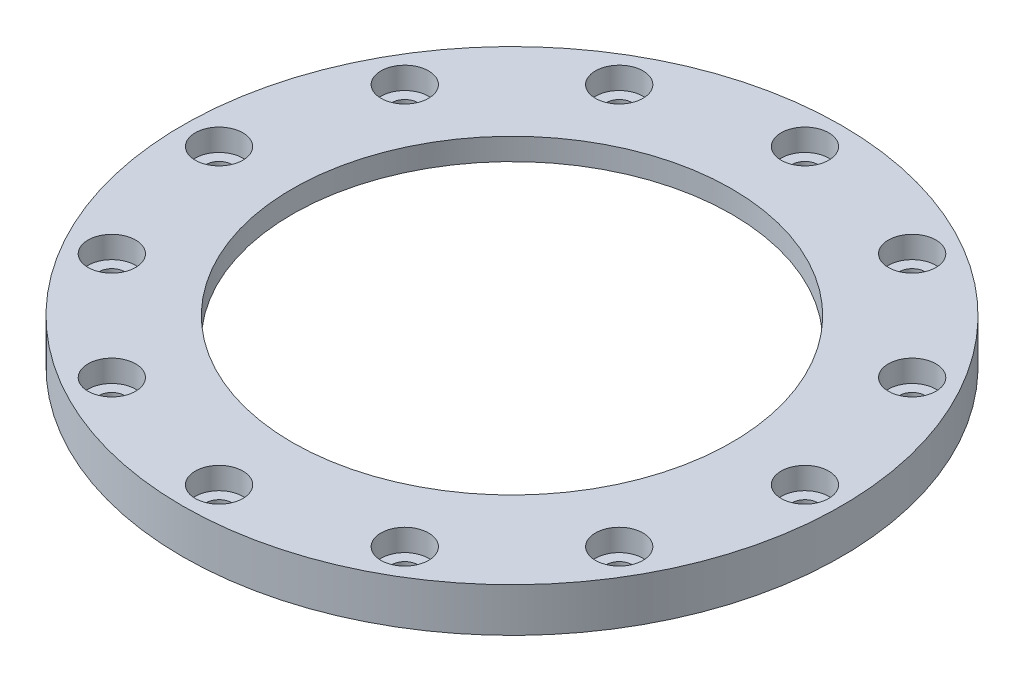
from build123d import *

# Parameters (mm, degrees)
SKETCH1_R           = 45
SKETCH1_R_2         = 30
SKETCH1_R_3         = 1.75
BOSS_EXTRUDE1_DEPTH = 6
SKETCH2_R           = 36
CUT_EXTRUDE1_DEPTH  = 3
SKETCH3_R           = 3.25
CUT_EXTRUDE2_DEPTH  = 3


with BuildPart() as part:
    # Sketch1 → Boss-Extrude1 (new body)
    with BuildSketch(Plane(origin=(0, 0, 0), x_dir=(1, 0, 0), z_dir=(0, 1, 0))):
        with Locations(Location((0, 0, 0), (0, 0, 270))):
            Circle(SKETCH1_R)
        with Locations(Location((0, 0, 0), (0, 0, 270))):
            Circle(SKETCH1_R_2, mode=Mode.SUBTRACT)
        with Locations(Location((0, 40, 0), (0, 0, 270))):
            Circle(SKETCH1_R_3, mode=Mode.SUBTRACT)
        with Locations(Location((20, 34.641016151, 0), (0, 0, 270))):
            Circle(SKETCH1_R_3, mode=Mode.SUBTRACT)
        with Locations(Location((34.641016151, 20, 0), (0, 0, 270))):
            Circle(SKETCH1_R_3, mode=Mode.SUBTRACT)
        with Locations(Location((40, 0, 0), (0, 0, 270))):
            Circle(SKETCH1_R_3, mode=Mode.SUBTRACT)
        with Locations(Location((34.641016151, -20, 0), (0, 0, 270))):
            Circle(SKETCH1_R_3, mode=Mode.SUBTRACT)
        with Locations(Location((20, -34.641016151, 0), (0, 0, 270))):
            Circle(SKETCH1_R_3, mode=Mode.SUBTRACT)
        with Locations(Location((0, -40, 0), (0, 0, 270))):
            Circle(SKETCH1_R_3, mode=Mode.SUBTRACT)
        with Locations(Location((-20, -34.641016151, 0), (0, 0, 270))):
            Circle(SKETCH1_R_3, mode=Mode.SUBTRACT)
        with Locations(Location((-34.641016151, -20, 0), (0, 0, 270))):
            Circle(SKETCH1_R_3, mode=Mode.SUBTRACT)
        with Locations(Location((-40, 0, 0), (0, 0, 270))):
            Circle(SKETCH1_R_3, mode=Mode.SUBTRACT)
        with Locations(Location((-34.641016151, 20, 0), (0, 0, 270))):
            Circle(SKETCH1_R_3, mode=Mode.SUBTRACT)
        with Locations(Location((-20, 34.641016151, 0), (0, 0, 270))):
            Circle(SKETCH1_R_3, mode=Mode.SUBTRACT)
    extrude(amount=BOSS_EXTRUDE1_DEPTH)

    # Sketch2 → Cut-Extrude1 (cut)
    with BuildSketch(Plane.XZ):
        with Locations(Location((0, 0, 0), (0, 0, 270))):
            Circle(SKETCH2_R)
    extrude(amount=-CUT_EXTRUDE1_DEPTH, mode=Mode.SUBTRACT)

    # Sketch3 → Cut-Extrude2 (cut)
    with BuildSketch(Plane(origin=(0, 6, 0), x_dir=(1, 0, 0), z_dir=(0, 1, 0))):
        with Locations(Location((40, 0, 0), (0, 0, 270))):
            Circle(SKETCH3_R)
        with Locations(Location((34.641016151, -20, 0), (0, 0, 270))):
            Circle(SKETCH3_R)
        with Locations(Location((20, -34.641016151, 0), (0, 0, 270))):
            Circle(SKETCH3_R)
        with Locations(Location((0, -40, 0), (0, 0, 270))):
            Circle(SKETCH3_R)
        with Locations(Location((-20, -34.641016151, 0), (0, 0, 270))):
            Circle(SKETCH3_R)
        with Locations(Location((-34.641016151, -20, 0), (0, 0, 270))):
            Circle(SKETCH3_R)
        with Locations(Location((-40, 0, 0), (0, 0, 270))):
            Circle(SKETCH3_R)
        with Locations(Location((-34.641016151, 20, 0), (0, 0, 270))):
            Circle(SKETCH3_R)
        with Locations(Location((-20, 34.641016151, 0), (0, 0, 270))):
            Circle(SKETCH3_R)
        with Locations(Location((0, 40, 0), (0, 0, 270))):
            Circle(SKETCH3_R)
        with Locations(Location((20, 34.641016151, 0), (0, 0, 270))):
            Circle(SKETCH3_R)
        with Locations(Location((34.641016151, 20, 0), (0, 0, 270))):
            Circle(SKETCH3_R)
    extrude(amount=-CUT_EXTRUDE2_DEPTH, mode=Mode.SUBTRACT)


solid = part.part
